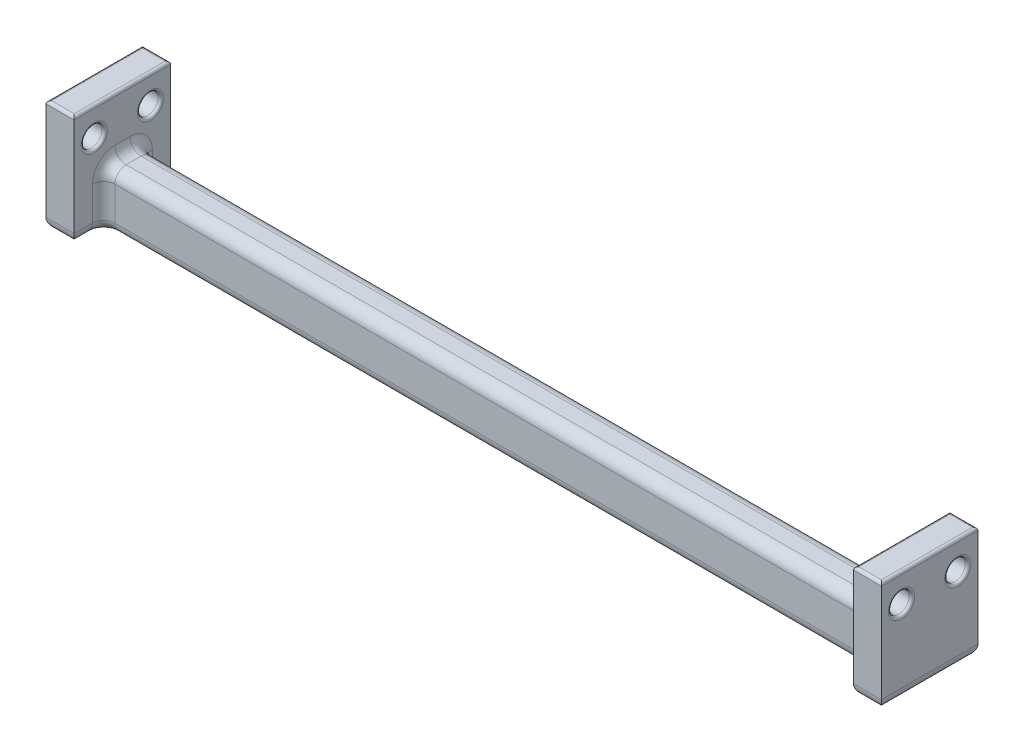
from build123d import *

# Parameters (mm, degrees)
BOSS_EXTRUDE1_DEPTH = 12.7
SKETCH3_W           = 6.35
SKETCH3_H           = 21.844
BOSS_EXTRUDE2_DEPTH = 12.7
SKETCH4_R           = 2.3368
CUT_EXTRUDE1_DEPTH  = 191.92507101
FILLET1_R           = 2.54
FILLET2_R           = 0.635


with BuildPart() as part:
    # Sketch2 → Boss-Extrude1 (new body)
    with BuildSketch(Plane(origin=(0, 0, 0), x_dir=(1, 0, 0), z_dir=(0, 1, 0))):
        Polygon((-88.10625, 10.922), (-94.45625, 10.922), (-94.45625, -10.922), (-88.10625, -10.922), (-88.10625, -4.233333333), (88.10625, -4.233333333), (88.10625, -10.922), (94.45625, -10.922), (94.45625, 10.922), (88.10625, 10.922), (88.10625, 4.233333333), (-88.10625, 4.233333333), align=None)
    extrude(amount=BOSS_EXTRUDE1_DEPTH)

    # Sketch3 → Boss-Extrude2 (add)
    with BuildSketch(Plane(origin=(0, 12.7, 0), x_dir=(1, 0, 0), z_dir=(0, 1, 0))):
        with Locations((-91.28125, 0)):
            Rectangle(SKETCH3_W, SKETCH3_H)
        with Locations((91.28125, 0)):
            Rectangle(SKETCH3_W, SKETCH3_H)
    extrude(amount=BOSS_EXTRUDE2_DEPTH)

    # Sketch4 → Cut-Extrude1 (cut, through all)
    with BuildSketch(Plane.ZY.offset(94.45625)):
        with Locations((-6.35, 19.05)):
            Circle(SKETCH4_R)
        with Locations((6.35, 19.05)):
            Circle(SKETCH4_R)
    extrude(amount=-CUT_EXTRUDE1_DEPTH, mode=Mode.SUBTRACT)

    # Fillet1
    fillet1_edges = [part.edges().sort_by_distance(p)[0] for p in [
        (0, 0, -4.233333333),
        (88.10625, 0, -7.577666667),
        (91.28125, 0, -10.922),
        (94.45625, 0, 0),
        (91.28125, 0, 10.922),
        (88.10625, 0, 7.577666667),
        (0, 0, 4.233333333),
        (-88.10625, 0, 7.577666667),
        (-91.28125, 0, 10.922),
        (-94.45625, 0, 0),
        (-91.28125, 0, -10.922),
        (-88.10625, 0, -7.577666667),
        (-88.10625, 6.35, -4.233333333),
        (88.10625, 6.35, -4.233333333),
        (88.10625, 6.35, 4.233333333),
        (-88.10625, 6.35, 4.233333333),
        (0, 12.7, 4.233333333),
        (88.10625, 12.7, 0),
        (-88.10625, 12.7, 0),
        (0, 12.7, -4.233333333),
    ]]
    fillet(fillet1_edges, radius=FILLET1_R)

    # Fillet2
    fillet2_edges = [part.edges().sort_by_distance(p)[0] for p in [
        (-88.10625, 25.4, 0),
        (-91.28125, 25.4, -10.922),
        (-94.45625, 25.4, 0),
        (-91.28125, 25.4, 10.922),
        (94.45625, 25.4, 0),
        (91.28125, 25.4, -10.922),
        (88.10625, 25.4, 0),
        (91.28125, 25.4, 10.922),
        (-88.10625, 19.05, -8.6868),
        (94.45625, 19.05, -8.6868),
        (88.10625, 19.05, -8.6868),
        (-94.45625, 19.05, -8.6868),
        (-88.10625, 19.05, 4.0132),
        (94.45625, 19.05, 4.0132),
        (88.10625, 19.05, 4.0132),
        (-94.45625, 19.05, 4.0132),
    ]]
    fillet(fillet2_edges, radius=FILLET2_R)


solid = part.part
